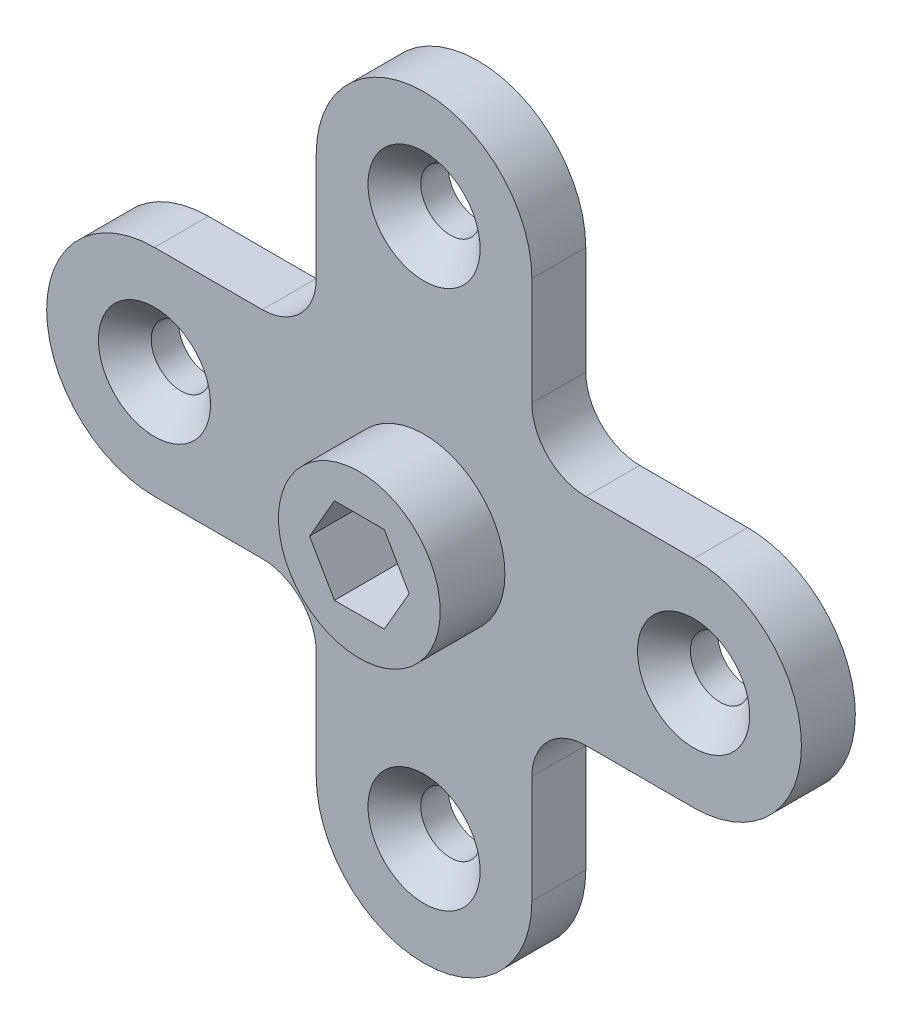
from build123d import *

# Parameters (mm, degrees)
EXTRUDE_1_DEPTH             = 2.5
HOLE_WIZARD_M5_1_AT_2_COUNT = 2
HOLE_WIZARD_M5_1_AT_2_PITCH = 50
HOLE_WIZARD_M5_1_AT_3_COUNT = 2
HOLE_WIZARD_M5_1_AT_3_PITCH = 35.355339059
HOLE_WIZARD_M5_1_AT_4_COUNT = 2
HOLE_WIZARD_M5_1_AT_4_PITCH = 35.355339059
FILLET_1_R                  = 5
SKETCH_14_R                 = 7.5
EXTRUDE_2_DEPTH             = 6


with BuildPart() as part:
    # 草圖1 → 填料-伸長1 (new, symmetric)
    with BuildSketch(Plane.XY):
        with BuildLine():
            Line((10, 25), (10, 10))
            Line((10, 10), (25, 10))
            ThreePointArc((25, 10), (35, 0), (25, -10))
            Line((25, -10), (10, -10))
            Line((10, -10), (10, -25))
            ThreePointArc((10, -25), (0, -35), (-10, -25))
            Line((-10, -25), (-10, -10))
            Line((-10, -10), (-25, -10))
            ThreePointArc((-25, -10), (-35, 0), (-25, 10))
            Line((-25, 10), (-10, 10))
            Line((-10, 10), (-10, 25))
            ThreePointArc((-10, 25), (0, 35), (10, 25))
        make_face()
    extrude(amount=EXTRUDE_1_DEPTH, both=True)

    # 草圖6 → M5 錐坑平頭螺釘的錐孔1 (revolve, cut)
    with BuildSketch(Plane(origin=(0, 25, 2.5), x_dir=(0, -1, 0), z_dir=(1, 0, 0))):
        Polygon((0, 0), (0, 5), (2.75, 5), (2.75, 2.45), (5.2, 0), align=None)
    hole_wizard_m5_1 = revolve(axis=Axis((0, 25, 8.85), (0, 0, -1)), mode=Mode.SUBTRACT)

    # M5 錐坑平頭螺釘的錐孔1 at 2: M5 錐坑平頭螺釘的錐孔1 ×2
    with Locations(*[(0, -i * HOLE_WIZARD_M5_1_AT_2_PITCH, 0) for i in range(1, HOLE_WIZARD_M5_1_AT_2_COUNT)]):
        add(hole_wizard_m5_1, mode=Mode.SUBTRACT)

    # M5 錐坑平頭螺釘的錐孔1 at 3: M5 錐坑平頭螺釘的錐孔1 ×2
    with Locations(*[Vector(0.7071067811865479, -0.7071067811865472, 0) * (i * HOLE_WIZARD_M5_1_AT_3_PITCH) for i in range(1, HOLE_WIZARD_M5_1_AT_3_COUNT)]):
        add(hole_wizard_m5_1, mode=Mode.SUBTRACT)

    # M5 錐坑平頭螺釘的錐孔1 at 4: M5 錐坑平頭螺釘的錐孔1 ×2
    with Locations(*[Vector(-0.7071067811865476, -0.7071067811865476, 0) * (i * HOLE_WIZARD_M5_1_AT_4_PITCH) for i in range(1, HOLE_WIZARD_M5_1_AT_4_COUNT)]):
        add(hole_wizard_m5_1, mode=Mode.SUBTRACT)

    # 圓角1
    fillet_1_edges = [part.edges().sort_by_distance(p)[0] for p in [
        (10, 10, 0),
        (10, -10, 0),
        (-10, -10, 0),
        (-10, 10, 0),
    ]]
    fillet(fillet_1_edges, radius=FILLET_1_R)

    # 草圖13 → M5 錐坑平頭螺釘的錐孔3 (revolve, cut)
    with BuildSketch(Plane(origin=(0, 0, -2.5), x_dir=(0, 1, 0), z_dir=(1, 0, 0))):
        Polygon((0, 0), (0, 5), (2.75, 5), (2.75, 2.45), (5.2, 0), align=None)
    revolve(axis=Axis((0, 0, -8.85), (0, 0, 1)), mode=Mode.SUBTRACT)

    # 草圖14 → 填料-伸長2 (add)
    with BuildSketch(Plane.XY.offset(2.5)):
        Circle(SKETCH_14_R)
        Polygon((2.309401077, 4), (-2.309401077, 4), (-4.618802154, 0), (-2.309401077, -4), (2.309401077, -4), (4.618802154, 0), align=None, mode=Mode.SUBTRACT)
    extrude(amount=EXTRUDE_2_DEPTH)


solid = part.part
